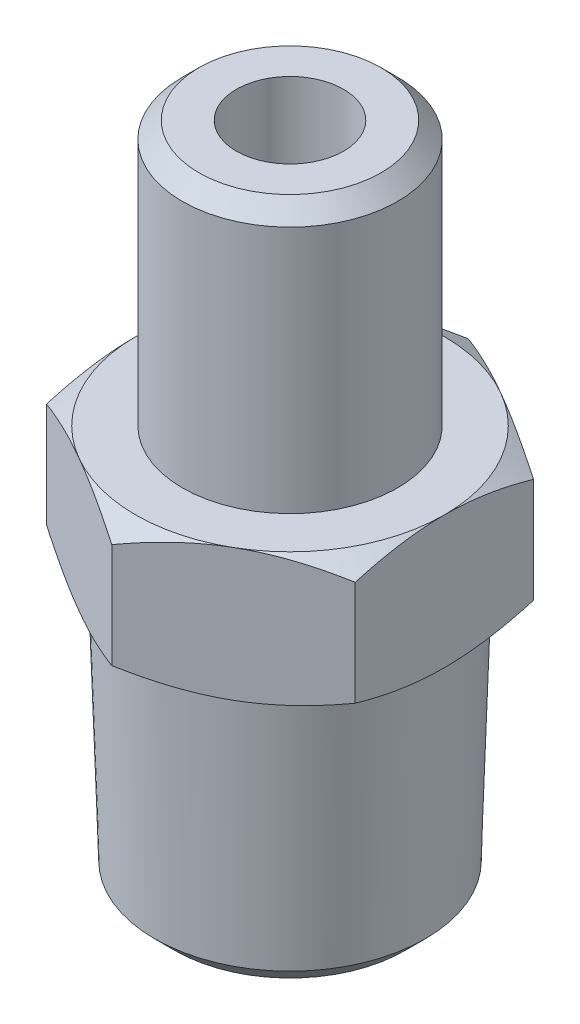
from build123d import *

# Parameters (mm, degrees)
SKETCH7_R               = 5.1435
BOSS_EXTRUDE3_DEPTH     = 9.525
BOSS_EXTRUDE3_DRAFT     = -1.783333333
BOSS_EXTRUDE4_DEPTH     = 4.7625
SKETCH9_R               = 3.8735
BOSS_EXTRUDE5_DEPTH     = 9.525
SKETCH10_R              = 1.9304
CUT_EXTRUDE1_DEPTH      = 26.279826392
SKETCH11_OUTSIDE_W      = 79.992
SKETCH11_OUTSIDE_H      = 81.712
SKETCH11_OUTSIDE_R      = 5.55625
CUT_EXTRUDE2_DEPTH      = 17.618276758
CUT_EXTRUDE2_DRAFT      = 60
MIRROR1_COPY_1_SKETCH_W = 79.992
MIRROR1_COPY_1_SKETCH_H = 81.712
MIRROR1_COPY_1_SKETCH_R = 5.55625
MIRROR1_COPY_1_DEPTH    = 17.618276758
MIRROR1_COPY_1_DRAFT    = 60
CHAMFER1_SIZE           = 0.705555556
CHAMFER1_SIZE2          = 0.728581919
CHAMFER2_SIZE           = 0.5953125


with BuildPart() as part:
    # Sketch7 → Boss-Extrude3 (with draft: the straight prism first)
    with BuildSketch(Plane(origin=(0, 9.525, 0), x_dir=(1, 0, 0), z_dir=(0, 1, 0))):
        Circle(SKETCH7_R)
    extrude(amount=-BOSS_EXTRUDE3_DEPTH)
    # Boss-Extrude3: the draft: its side faces are tilted about the plane it starts from
    boss_extrude3_sides = [part.faces().sort_by_distance(p)[0] for p in [
        (-5.1435, 4.7625, 0),
    ]]
    draft(boss_extrude3_sides, Plane(origin=(0, 9.525, 0), x_dir=(1, 0, 0), z_dir=(0, 1, 0)), BOSS_EXTRUDE3_DRAFT)

    # Sketch8 → Boss-Extrude4 (add)
    with BuildSketch(Plane(origin=(0, 9.525, 0), x_dir=(1, 0, 0), z_dir=(0, 1, 0))):
        Polygon((5.55625, -3.207902433), (5.55625, 3.207902433), (0, 6.415804866), (-5.55625, 3.207902433), (-5.55625, -3.207902433), (0, -6.415804866), align=None)
    extrude(amount=BOSS_EXTRUDE4_DEPTH)

    # Sketch9 → Boss-Extrude5 (add)
    with BuildSketch(Plane(origin=(0, 23.8125, 0), x_dir=(1, 0, 0), z_dir=(0, 1, 0))):
        with Locations(Location((0, 0, 0), (0, 0, 270))):
            Circle(SKETCH9_R)
    extrude(amount=-BOSS_EXTRUDE5_DEPTH)

    # Sketch10 → Cut-Extrude1 (cut, through all)
    with BuildSketch(Plane(origin=(0, 0, 0), x_dir=(1, 0, 0), z_dir=(0, 1, 0))):
        with Locations(Location((0, 0, 0), (0, 0, 270))):
            Circle(SKETCH10_R)
    extrude(amount=CUT_EXTRUDE1_DEPTH, mode=Mode.SUBTRACT)


with BuildPart() as cut_extrude2_tool:
    # Sketch11 outside → Cut-Extrude2 (with draft: the straight prism first)
    with BuildSketch(Plane(origin=(0, 9.525, 0), x_dir=(1, 0, 0), z_dir=(0, 1, 0))):
        Rectangle(SKETCH11_OUTSIDE_W, SKETCH11_OUTSIDE_H)
        Circle(SKETCH11_OUTSIDE_R, mode=Mode.SUBTRACT)
    extrude(amount=CUT_EXTRUDE2_DEPTH)
    # Cut-Extrude2: the draft: its side faces are tilted about the plane it starts from
    cut_extrude2_sides = [cut_extrude2_tool.faces().sort_by_distance(p)[0] for p in [
        (0, 18.334138379, 40.856),
        (39.996, 18.334138379, 0),
        (0, 18.334138379, -40.856),
        (-39.996, 18.334138379, 0),
        (-5.55625, 18.334138379, 0),
    ]]
    draft(cut_extrude2_sides, Plane(origin=(0, 9.525, 0), x_dir=(1, 0, 0), z_dir=(0, 1, 0)), CUT_EXTRUDE2_DRAFT)


with BuildPart() as part_1:
    add(part.part)

    # Cut-Extrude2: cut by cut_extrude2_tool
    add(cut_extrude2_tool.part, mode=Mode.SUBTRACT)


with BuildPart() as mirror1_copy_1_tool:
    # Mirror1 copy 1 sketch → Mirror1 copy 1 (with draft: the straight prism first)
    with BuildSketch(Plane.XZ.offset(-14.2875)):
        Rectangle(MIRROR1_COPY_1_SKETCH_W, MIRROR1_COPY_1_SKETCH_H)
        Circle(MIRROR1_COPY_1_SKETCH_R, mode=Mode.SUBTRACT)
    extrude(amount=MIRROR1_COPY_1_DEPTH)
    # Mirror1 copy 1: the draft: its side faces are tilted about the plane it starts from
    mirror1_copy_1_sides = [mirror1_copy_1_tool.faces().sort_by_distance(p)[0] for p in [
        (0, 5.478361621, 40.856),
        (39.996, 5.478361621, 0),
        (0, 5.478361621, -40.856),
        (-39.996, 5.478361621, 0),
        (-5.55625, 5.478361621, 0),
    ]]
    draft(mirror1_copy_1_sides, Plane.XZ.offset(-14.2875), MIRROR1_COPY_1_DRAFT)


with BuildPart() as part_2:
    add(part_1.part)

    # Mirror1 copy 1: cut by mirror1_copy_1_tool
    add(mirror1_copy_1_tool.part, mode=Mode.SUBTRACT)

    # Chamfer1
    chamfer1_edges = [part_2.edges().sort_by_distance(p)[0] for p in [
        (-4.846938237, 0, 0),
    ]]
    chamfer1_side = [part_2.faces().sort_by_distance(p)[0] for p in [
        (-4.709846121, 0, 0),
    ]]
    chamfer(chamfer1_edges, length=CHAMFER1_SIZE, length2=CHAMFER1_SIZE2, reference=chamfer1_side[0])

    # Chamfer2
    chamfer2_edges = [part_2.edges().sort_by_distance(p)[0] for p in [
        (0, 23.8125, -3.8735),
    ]]
    chamfer(chamfer2_edges, length=CHAMFER2_SIZE)


solid = part_2.part
